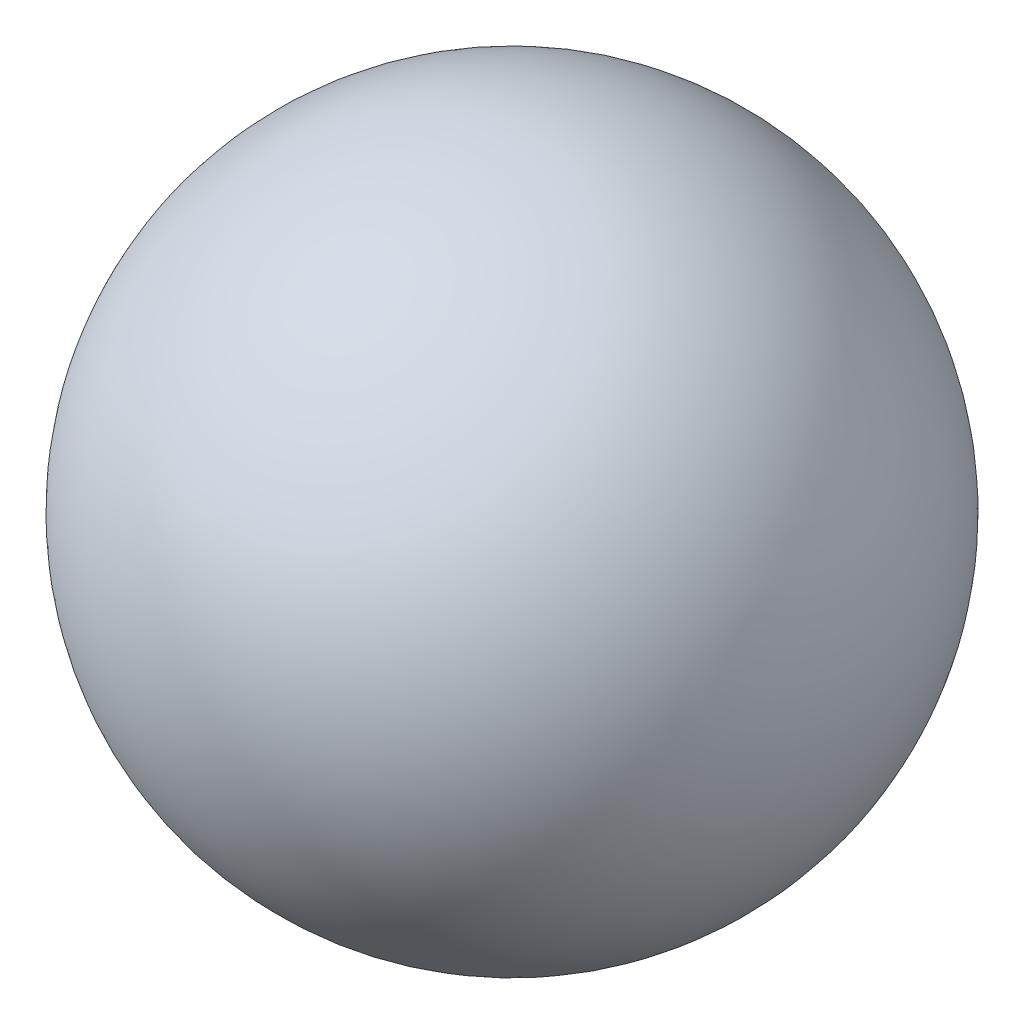
from build123d import *


with BuildPart() as part:
    # Sketch1 → Revolve2 (revolve)
    with BuildSketch(Plane(origin=(0, 0, 0), x_dir=(1, 0, 0), z_dir=(0, 1, 0))):
        with BuildLine():
            Line((14.734819389, 0), (22.354819389, 0))
            ThreePointArc((22.354819389, 0), (18.544819389, 3.81), (14.734819389, 0))
        make_face()
    revolve(axis=Axis((0, 0, 0), (1, 0, 0)))


solid = part.part
